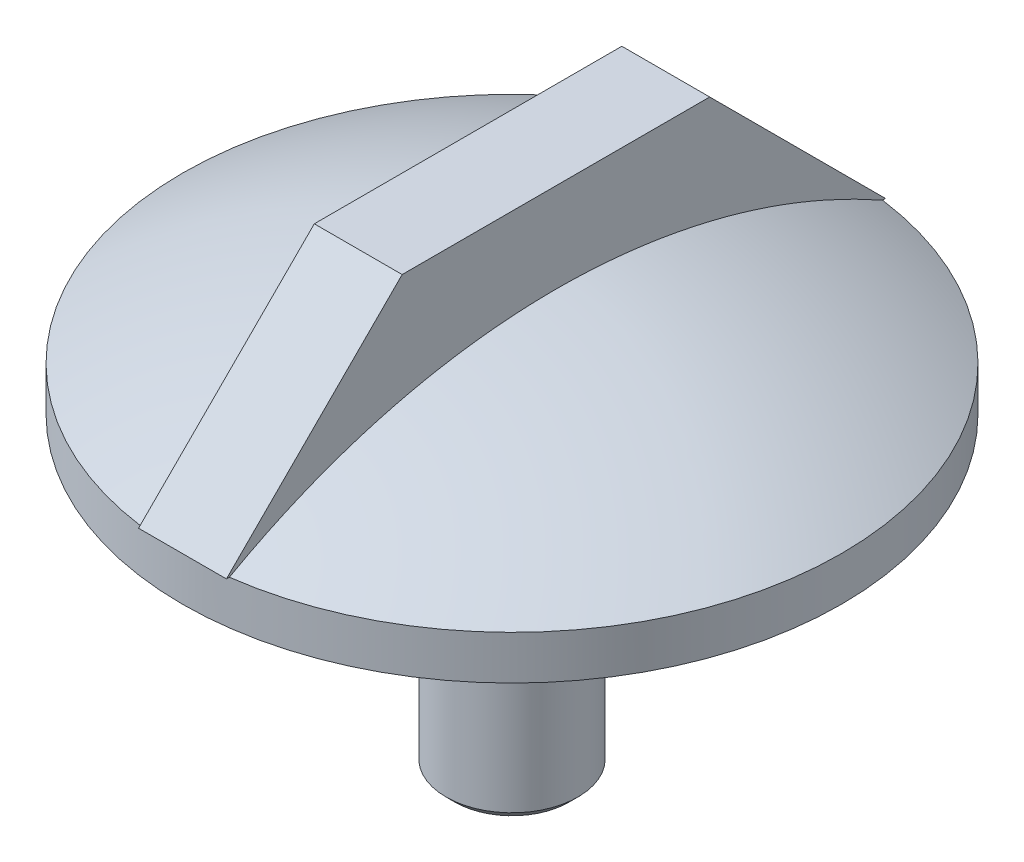
from build123d import *

# Parameters (mm, degrees)
SKETCH1_R                = 7.5
BOSS_EXTRUDE1_DEPTH      = 1
BOSS_EXTRUDE2_DEPTH      = 1
BOSS_EXTRUDE2_DEPTH_BACK = 1
SKETCH5_R                = 1.5
BOSS_EXTRUDE3_DEPTH      = 7
CHAMFER1_SIZE            = 0.2


with BuildPart() as part:
    # Sketch1 → Boss-Extrude1 (new body)
    with BuildSketch(Plane(origin=(0, 0, 0), x_dir=(1, 0, 0), z_dir=(0, 1, 0))):
        Circle(SKETCH1_R)
    extrude(amount=BOSS_EXTRUDE1_DEPTH)

    # Sketch3 → Revolve1 (revolve)
    with BuildSketch(Plane.XY):
        with BuildLine():
            Line((0, 1), (0, 3))
            add(Edge.make_bspline(
                [(7.5, 1), (4.015025373, 2.967534518), (0, 3)],
                knots=[0, 0, 0, 1, 1, 1], degree=2))
            Line((7.5, 1), (0, 1))
        make_face()
    revolve(axis=Axis((0, 1, 0), (0, 1, 0)))

    # Sketch4 → Boss-Extrude2 (add, two sides: drawn at the far end of the back side and taken through both)
    with BuildSketch(Plane(origin=(0, 0, 0), x_dir=(0, 0, -1), z_dir=(1, 0, 0)).offset(-BOSS_EXTRUDE2_DEPTH_BACK)):
        Polygon((-7.5, 1), (-3.499989483, 1), (3.500010517, 1), (7.5, 1), (3.500010517, 5), (-3.499989483, 5), align=None)
    extrude(amount=BOSS_EXTRUDE2_DEPTH + BOSS_EXTRUDE2_DEPTH_BACK)

    # Sketch5 → Boss-Extrude3 (add)
    with BuildSketch(Plane.XZ):
        Circle(SKETCH5_R)
    extrude(amount=BOSS_EXTRUDE3_DEPTH)

    # Chamfer1
    chamfer1_edges = [part.edges().sort_by_distance(p)[0] for p in [
        (-1.5, -7, 0),
    ]]
    chamfer(chamfer1_edges, length=CHAMFER1_SIZE)


solid = part.part
